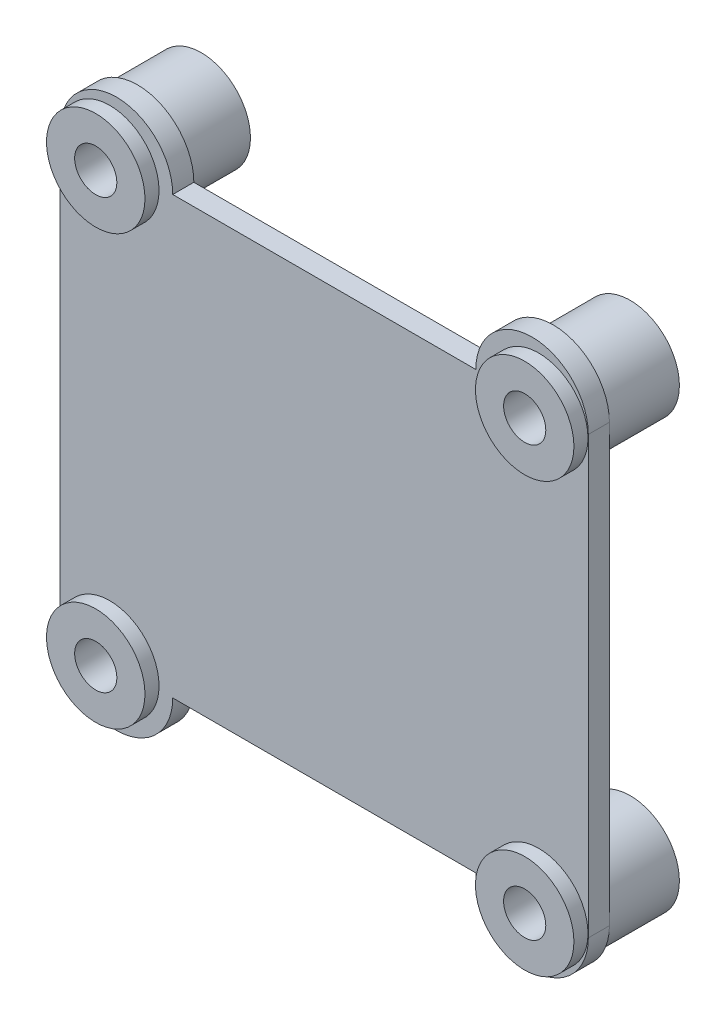
from build123d import *

# Parameters (mm, degrees)
CROQUIS1_R              = 2.5
SALIENTE_EXTRUIR1_DEPTH = 1.5
MATRIZL1_COUNT          = 2
MATRIZL1_PITCH          = 30.5
MATRIZL1_COUNT_DIR2     = 2
MATRIZL1_PITCH_DIR2     = 30.5


with BuildPart() as part:
    # Croquis1 → Saliente-Extruir1 (new body)
    with BuildSketch(Plane.XY):
        with BuildLine():
            Line((17.88322612, 13.695977011), (17.88322612, -17.304022989))
            ThreePointArc((17.88322612, -17.304022989), (13.88322612, -21.304022989), (9.88322612, -17.304022989))
            Line((9.88322612, -17.304022989), (-11.66677388, -17.304022989))
            ThreePointArc((-11.66677388, -17.304022989), (-15.66677388, -21.304022989), (-19.66677388, -17.304022989))
            Line((-19.66677388, -17.304022989), (-19.66677388, 13.695977011))
            ThreePointArc((-19.66677388, 13.695977011), (-15.66677388, 17.695977011), (-11.66677388, 13.695977011))
            Line((-11.66677388, 13.695977011), (9.88322612, 13.695977011))
            ThreePointArc((9.88322612, 13.695977011), (13.88322612, 17.695977011), (17.88322612, 13.695977011))
        make_face()
        with Locations((-16.14177388, 13.445977011)):
            Circle(CROQUIS1_R, mode=Mode.SUBTRACT)
        with Locations((14.35822612, 13.445977011)):
            Circle(CROQUIS1_R, mode=Mode.SUBTRACT)
        with Locations((14.35822612, -17.054022989)):
            Circle(CROQUIS1_R, mode=Mode.SUBTRACT)
        with Locations((-16.14177388, -17.054022989)):
            Circle(CROQUIS1_R, mode=Mode.SUBTRACT)
    extrude(amount=SALIENTE_EXTRUIR1_DEPTH)

    # Croquis3 → Revolución1 (revolve)
    with BuildSketch(Plane(origin=(0, -17.054022989, 0), x_dir=(-1, 0, 0), z_dir=(0, -1, 0)), mode=Mode.PRIVATE) as revoluci_n1_sk:
        Polygon((18.64177388, -1.5), (19.64177388, -1.5), (19.64177388, -2.5), (17.64177388, -2.5), (17.64177388, 5), (19.64177388, 5), (19.64177388, 0), (18.64177388, 0), align=None)
    revoluci_n1 = revolve(revoluci_n1_sk.sketch.rotate(Axis((-16.14177388, -17.054022989, 2.5), (0, 0, -1)), 180), axis=Axis((-16.14177388, -17.054022989, 2.5), (0, 0, -1)))

    # MatrizL1: Revoluci_n1 2 × 2
    with Locations(*[(i * MATRIZL1_PITCH, j * MATRIZL1_PITCH_DIR2, 0) for i in range(MATRIZL1_COUNT) for j in range(MATRIZL1_COUNT_DIR2) if (i, j) != (0, 0)]):
        add(revoluci_n1)


solid = part.part
